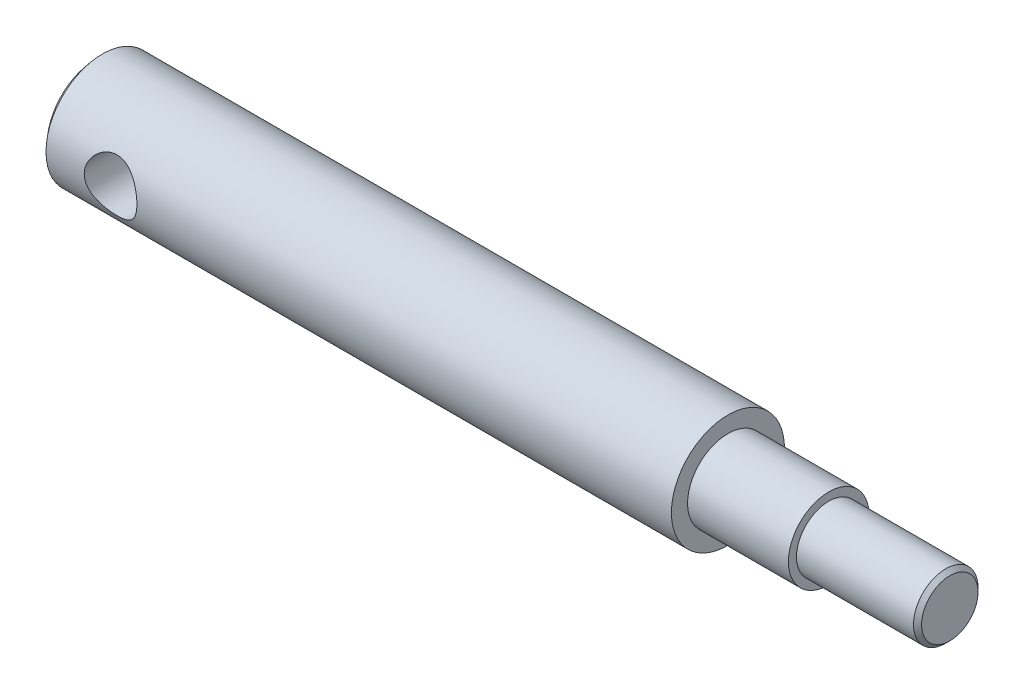
from build123d import *

# Parameters (mm, degrees)
SKETCH2_R          = 6.525
CUT_EXTRUDE1_DEPTH = 20


with BuildPart() as part:
    # Sketch1 → Revolve1 (revolve)
    with BuildSketch(Plane.XY, mode=Mode.PRIVATE) as revolve1_sk:
        with BuildLine():
            Line((186, 10), (161, 10))
            Line((161, 10), (161, 14))
            Line((161, 14), (6, 14))
            ThreePointArc((6, 14), (1.749749003, 7.535821856), (0, 0))
            Line((0, 0), (216, 0))
            Line((216, 0), (216, 7))
            Line((216, 7), (215, 8))
            Line((215, 8), (186, 8))
            Line((186, 8), (186, 10))
        make_face()
    revolve(revolve1_sk.sketch.rotate(Axis((0, 0, 0), (1, 0, 0)), 90), axis=Axis((0, 0, 0), (1, 0, 0)))

    # Sketch2 → Cut-Extrude1 (cut, symmetric)
    with BuildSketch(Plane.XY):
        with Locations((22, 0)):
            Circle(SKETCH2_R)
    extrude(amount=CUT_EXTRUDE1_DEPTH, both=True, mode=Mode.SUBTRACT)


solid = part.part
